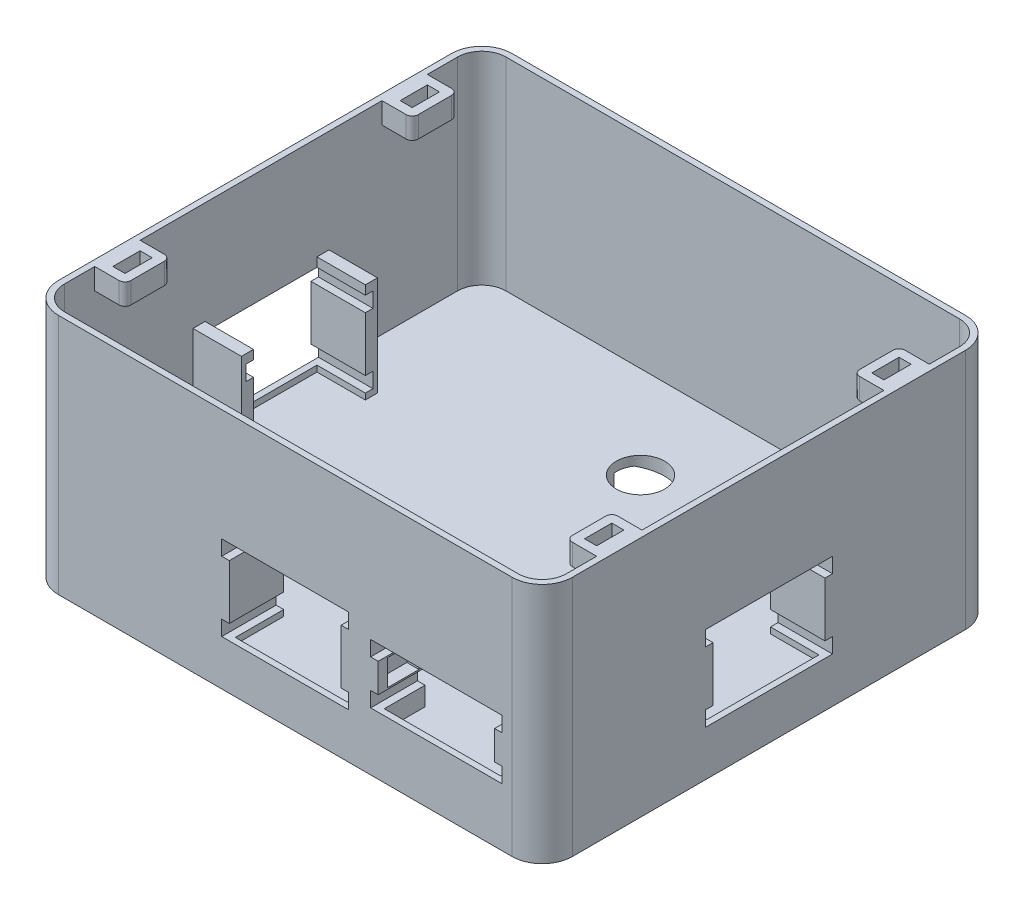
from build123d import *

# Parameters (mm, degrees)
SKETCH2_W                                  = 170
SKETCH2_H                                  = 150
BOSS_EXTRUDE1_DEPTH                        = 80
FILLET1_R                                  = 10
SHELL1_T                                   = -2
SHELL1_THICKNESS_2_DEPTH                   = 11
SKETCH5_W                                  = 2.5
SKETCH5_H                                  = 5
CUT_EXTRUDE1_DEPTH                         = 2
BOSS_EXTRUDE2_DEPTH                        = 16
SKETCH7_W                                  = 2.5
SKETCH7_H                                  = 5
CUT_EXTRUDE2_DEPTH                         = 2
BOSS_EXTRUDE3_DEPTH                        = 16
SKETCH10_W                                 = 2.5
SKETCH10_H                                 = 5
CUT_EXTRUDE4_DEPTH                         = 2
BOSS_EXTRUDE4_DEPTH                        = 16
SKETCH13_W                                 = 2.5
SKETCH13_H                                 = 5
CUT_EXTRUDE5_DEPTH                         = 2
BOSS_EXTRUDE5_DEPTH                        = 13.5
SKETCH15_W                                 = 10.5
SKETCH15_H                                 = 8.6
CUT_EXTRUDE6_DEPTH                         = 4
CUT_EXTRUDE8_REACH                         = 140.744
SKETCH20_R                                 = 8
SKETCH22_R                                 = 3
CUT_EXTRUDE9_DEPTH                         = 5
BOSS_EXTRUDE6_START                        = 60
SKETCH23_W                                 = 10
SKETCH23_H                                 = 15
BOSS_EXTRUDE6_DEPTH                        = 7
SKETCH24_W                                 = 4
SKETCH24_H                                 = 9
CUT_EXTRUDE10_DEPTH                        = 5
MIRROR1_START                              = 60
MIRROR1_AT_THE_SECOND_PLANE_COPY_1_SKETC_W = 10
MIRROR1_AT_THE_SECOND_PLANE_COPY_1_SKETC_H = 15
MIRROR1_AT_THE_SECOND_PLANE_COPY_1_DEPTH   = 7
MIRROR1_AT_THE_SECOND_PLANE_COPY_2_SKETC_W = 4
MIRROR1_AT_THE_SECOND_PLANE_COPY_2_SKETC_H = 9
MIRROR1_AT_THE_SECOND_PLANE_COPY_2_DEPTH   = 5
FILLET2_R                                  = 2
CUT_EXTRUDE14_DEPTH                        = 10
SKETCH30_R                                 = 6
CUT_EXTRUDE16_DEPTH                        = 10


with BuildPart() as part:
    # Sketch2 → Boss-Extrude1 (new body)
    with BuildSketch(Plane(origin=(0, 0, 0), x_dir=(1, 0, 0), z_dir=(0, 1, 0))):
        Rectangle(SKETCH2_W, SKETCH2_H)
    extrude(amount=BOSS_EXTRUDE1_DEPTH)

    # Fillet1
    fillet1_edges = [part.edges().sort_by_distance(p)[0] for p in [
        (85, 40, 75),
        (-85, 40, 75),
        (-85, 40, -75),
        (85, 40, -75),
    ]]
    fillet(fillet1_edges, radius=FILLET1_R)

    # Shell1
    shell1_openings = [part.faces().sort_by_distance(p)[0] for p in [
        (0, 80, 0),
    ]]
    offset(amount=SHELL1_T, openings=shell1_openings, kind=Kind.INTERSECTION)

    # Shell1 thickness 2 face (on inner face of the shell) → Shell1 thickness 2 (add)
    with BuildSketch(Plane(origin=(0, 2, 0), x_dir=(0, 0, -1), z_dir=(0, -1, 0))):
        with BuildLine():
            ThreePointArc((73, -75), (70.656854249, -80.656854249), (65, -83))
            Line((65, -83), (-65, -83))
            ThreePointArc((-65, -83), (-70.656854249, -80.656854249), (-73, -75))
            Line((-73, -75), (-73, 75))
            ThreePointArc((-73, 75), (-70.656854249, 80.656854249), (-65, 83))
            Line((-65, 83), (65, 83))
            ThreePointArc((65, 83), (70.656854249, 80.656854249), (73, 75))
            Line((73, 75), (73, -75))
        make_face()
    extrude(amount=-SHELL1_THICKNESS_2_DEPTH)

    # Sketch5 → Cut-Extrude1 (cut)
    with BuildSketch(Plane.XY.offset(75)):
        Polygon((18.5, 43), (-18.5, 43), (-18.5, 38), (-18.5, 20), (-18.5, 15), (18.5, 15), (18.5, 20), (18.5, 38), align=None)
        with Locations((-19.75, 40.5)):
            Rectangle(SKETCH5_W, SKETCH5_H)
        with Locations((19.75, 40.5)):
            Rectangle(SKETCH5_W, SKETCH5_H)
        with Locations((-19.75, 17.5)):
            Rectangle(SKETCH5_W, SKETCH5_H)
        with Locations((19.75, 17.5)):
            Rectangle(SKETCH5_W, SKETCH5_H)
    extrude(amount=-CUT_EXTRUDE1_DEPTH, mode=Mode.SUBTRACT)

    # Sketch6 → Boss-Extrude2 (add)
    with BuildSketch(Plane(origin=(0, 0, 73), x_dir=(-1, 0, 0), z_dir=(0, 0, -1))):
        Polygon((18.5, 13), (22.5, 13), (22.5, 46), (18.5, 46), (18.5, 43), (21, 43), (21, 38), (18.5, 38), (18.5, 20), (21, 20), (21, 15), (18.5, 15), align=None)
        Polygon((-22.5, 46), (-22.5, 13), (-18.5, 13), (-18.5, 15), (-21, 15), (-21, 20), (-18.5, 20), (-18.5, 38), (-21, 38), (-21, 43), (-18.5, 43), (-18.5, 46), align=None)
    extrude(amount=BOSS_EXTRUDE2_DEPTH)

    # Sketch7 → Cut-Extrude2 (cut)
    with BuildSketch(Plane(origin=(85, 0, 0), x_dir=(0, 0, -1), z_dir=(1, 0, 0))):
        Polygon((18.5, 43), (-18.5, 43), (-18.5, 38), (-18.5, 20), (-18.5, 15), (18.5, 15), (18.5, 20), (18.5, 38), align=None)
        with Locations((-19.75, 40.5)):
            Rectangle(SKETCH7_W, SKETCH7_H)
        with Locations((19.75, 40.5)):
            Rectangle(SKETCH7_W, SKETCH7_H)
        with Locations((-19.75, 17.5)):
            Rectangle(SKETCH7_W, SKETCH7_H)
        with Locations((19.75, 17.5)):
            Rectangle(SKETCH7_W, SKETCH7_H)
    extrude(amount=-CUT_EXTRUDE2_DEPTH, mode=Mode.SUBTRACT)

    # Sketch8 → Boss-Extrude3 (add)
    with BuildSketch(Plane.ZY.offset(-83)):
        Polygon((-22.5, 46), (-18.5, 46), (-18.5, 43), (-21, 43), (-21, 38), (-18.5, 38), (-18.5, 20), (-21, 20), (-21, 15), (-18.5, 15), (-18.5, 13), (-22.5, 13), align=None)
        Polygon((21, 43), (18.5, 43), (18.5, 46), (22.5, 46), (22.5, 13), (18.5, 13), (18.5, 15), (21, 15), (21, 20), (18.5, 20), (18.5, 38), (21, 38), align=None)
    extrude(amount=BOSS_EXTRUDE3_DEPTH)

    # Sketch10 → Cut-Extrude4 (cut)
    with BuildSketch(Plane.ZY.offset(85)):
        Polygon((18.5, 43), (-18.5, 43), (-18.5, 38), (-18.5, 20), (-18.5, 15), (18.5, 15), (18.5, 20), (18.5, 38), align=None)
        with Locations((-19.75, 40.5)):
            Rectangle(SKETCH10_W, SKETCH10_H)
        with Locations((19.75, 40.5)):
            Rectangle(SKETCH10_W, SKETCH10_H)
        with Locations((-19.75, 17.5)):
            Rectangle(SKETCH10_W, SKETCH10_H)
        with Locations((19.75, 17.5)):
            Rectangle(SKETCH10_W, SKETCH10_H)
    extrude(amount=-CUT_EXTRUDE4_DEPTH, mode=Mode.SUBTRACT)

    # Sketch11 → Boss-Extrude4 (add)
    with BuildSketch(Plane(origin=(-83, 0, 0), x_dir=(0, 0, -1), z_dir=(1, 0, 0))):
        Polygon((-18.5, 46), (-22.5, 46), (-22.5, 13), (-18.5, 13), (-18.5, 15), (-21, 15), (-21, 20), (-18.5, 20), (-18.5, 38), (-21, 38), (-21, 43), (-18.5, 43), align=None)
        Polygon((21, 43), (18.5, 43), (18.5, 46), (22.5, 46), (22.5, 13), (18.5, 13), (18.5, 15), (21, 15), (21, 20), (18.5, 20), (18.5, 38), (21, 38), align=None)
    extrude(amount=BOSS_EXTRUDE4_DEPTH)

    # Sketch13 → Cut-Extrude5 (cut)
    with BuildSketch(Plane.XY.offset(75)):
        with Locations((29.5, 36.3)):
            Rectangle(SKETCH13_W, SKETCH13_H)
        Polygon((69.25, 38.8), (30.75, 38.8), (30.75, 33.8), (30.75, 24.2), (30.75, 19.2), (69.25, 19.2), (69.25, 24.2), (69.25, 33.8), align=None)
        with Locations((70.5, 36.3)):
            Rectangle(SKETCH13_W, SKETCH13_H)
        with Locations((29.5, 21.7)):
            Rectangle(SKETCH13_W, SKETCH13_H)
        with Locations((70.5, 21.7)):
            Rectangle(SKETCH13_W, SKETCH13_H)
    extrude(amount=-CUT_EXTRUDE5_DEPTH, mode=Mode.SUBTRACT)

    # Sketch14 → Boss-Extrude5 (add)
    with BuildSketch(Plane(origin=(0, 0, 73), x_dir=(-1, 0, 0), z_dir=(0, 0, -1))):
        Polygon((-69.25, 41.8), (-73.25, 41.8), (-73.25, 13), (-69.25, 13), (-69.25, 19.2), (-71.75, 19.2), (-71.75, 24.2), (-69.25, 24.2), (-69.25, 33.8), (-71.75, 33.8), (-71.75, 38.8), (-69.25, 38.8), align=None)
        Polygon((-28.25, 38.8), (-30.75, 38.8), (-30.75, 41.8), (-26.75, 41.8), (-26.75, 13), (-30.75, 13), (-30.75, 19.2), (-28.25, 19.2), (-28.25, 24.2), (-30.75, 24.2), (-30.75, 33.8), (-28.25, 33.8), align=None)
    extrude(amount=BOSS_EXTRUDE5_DEPTH)

    # Sketch15 → Cut-Extrude6 (cut)
    with BuildSketch(Plane.ZY.offset(-26.75)):
        with Locations((66.75, 29)):
            Rectangle(SKETCH15_W, SKETCH15_H)
    extrude(amount=-CUT_EXTRUDE6_DEPTH, mode=Mode.SUBTRACT)

    # Sketch18 → Cut-Revolve1 (revolve, cut)
    with BuildSketch(Plane(origin=(0, 0, 0), x_dir=(0, 0, -1), z_dir=(1, 0, 0)), mode=Mode.PRIVATE) as cut_revolve1_sk:
        Polygon((-42.5, 0), (-70, 0), (-47.5, 10), (-42.5, 10), align=None)
    revolve(cut_revolve1_sk.sketch.rotate(Axis((0, 0, 0), (0, 1, 0)), 180), axis=Axis((0, 0, 0), (0, 1, 0)), mode=Mode.SUBTRACT)

    # Cut-Extrude8: up to this face of the body (flat: up to its plane)
    cut_extrude8_end = Plane(part.part.faces().sort_by_distance((-0.227953307, 13, -0.653255078))[0])
    # Sketch20 → Cut-Extrude8 (cut, up to the picked face)
    with BuildSketch(Plane.XZ, mode=Mode.PRIVATE) as cut_extrude8_sk1:
        with Locations(Location((0, -42.5, 0), (0, 0, 270))):
            Circle(SKETCH20_R)
    cut_extrude8_tool1 = split(extrude(cut_extrude8_sk1.sketch, amount=-CUT_EXTRUDE8_REACH, mode=Mode.PRIVATE), bisect_by=cut_extrude8_end, keep=Keep.BOTH, mode=Mode.PRIVATE)
    add(cut_extrude8_tool1.solids().sort_by(Axis((0, 0, -42.5), (0, 1, 0)))[0], mode=Mode.SUBTRACT)

    # Sketch22 → Cut-Extrude9 (cut)
    with BuildSketch(Plane.XZ):
        with Locations(Location((-67.928932188, 57.928932188, 0), (0, 0, 270))):
            Circle(SKETCH22_R)
        with Locations(Location((-67.928932188, -57.928932188, 0), (0, 0, 90))):
            Circle(SKETCH22_R)
        with Locations(Location((67.928932188, -57.928932188, 0), (0, 0, 270))):
            Circle(SKETCH22_R)
        with Locations(Location((67.928932188, 57.928932188, 0), (0, 0, 90))):
            Circle(SKETCH22_R)
    extrude(amount=-CUT_EXTRUDE9_DEPTH, mode=Mode.SUBTRACT)

    # Sketch23 → Boss-Extrude6 (add)
    with BuildSketch(Plane(origin=(0, 13, 0), x_dir=(1, 0, 0), z_dir=(0, 1, 0)).offset(BOSS_EXTRUDE6_START)):
        with Locations((-78, 47.5)):
            Rectangle(SKETCH23_W, SKETCH23_H)
    boss_extrude6 = extrude(amount=BOSS_EXTRUDE6_DEPTH)

    # Sketch24 → Cut-Extrude10 (cut)
    with BuildSketch(Plane(origin=(0, 80, 0), x_dir=(1, 0, 0), z_dir=(0, 1, 0))):
        with Locations((-78, 47.5)):
            Rectangle(SKETCH24_W, SKETCH24_H)
    cut_extrude10 = extrude(amount=-CUT_EXTRUDE10_DEPTH, mode=Mode.SUBTRACT)

    # Mirror1: Boss-Extrude6, Cut-Extrude10 across plane
    add(boss_extrude6.mirror(Plane(origin=(0, 0, 0), x_dir=(0, 0, 1), z_dir=(1, 0, 0))))
    add(cut_extrude10.mirror(Plane(origin=(0, 0, 0), x_dir=(0, 0, 1), z_dir=(1, 0, 0))), mode=Mode.SUBTRACT)

    # Mirror1 at the second plane: Boss-Extrude6, Cut-Extrude10 across plane
    add(boss_extrude6.mirror(Plane.XY))
    add(cut_extrude10.mirror(Plane.XY), mode=Mode.SUBTRACT)

    # Mirror1 at the second plane copy 1 sketc → Mirror1 at the second plane copy 1 (add)
    with BuildSketch(Plane(origin=(0, 13, 0), x_dir=(-1, 0, 0), z_dir=(0, 1, 0)).offset(MIRROR1_START)):
        with Locations((-78, 47.5)):
            Rectangle(MIRROR1_AT_THE_SECOND_PLANE_COPY_1_SKETC_W, MIRROR1_AT_THE_SECOND_PLANE_COPY_1_SKETC_H)
    extrude(amount=MIRROR1_AT_THE_SECOND_PLANE_COPY_1_DEPTH)

    # Mirror1 at the second plane copy 2 sketc → Mirror1 at the second plane copy 2 (cut)
    with BuildSketch(Plane(origin=(0, 80, 0), x_dir=(-1, 0, 0), z_dir=(0, 1, 0))):
        with Locations((-78, 47.5)):
            Rectangle(MIRROR1_AT_THE_SECOND_PLANE_COPY_2_SKETC_W, MIRROR1_AT_THE_SECOND_PLANE_COPY_2_SKETC_H)
    extrude(amount=-MIRROR1_AT_THE_SECOND_PLANE_COPY_2_DEPTH, mode=Mode.SUBTRACT)

    # Fillet2
    fillet2_edges = [part.edges().sort_by_distance(p)[0] for p in [
        (-73, 76.5, -40),
        (-73, 76.5, -55),
        (-73, 76.5, 40),
        (-73, 76.5, 55),
        (73, 76.5, -40),
        (73, 76.5, -55),
        (73, 76.5, 40),
        (73, 76.5, 55),
    ]]
    fillet(fillet2_edges, radius=FILLET2_R)

    # Sketch28 → Cut-Extrude14 (cut)
    with BuildSketch(Plane.XZ):
        with BuildLine():
            ThreePointArc((10.117209293, -38.182352941), (0, -31.5), (-10.117209293, -38.182352941))
            ThreePointArc((-10.117209293, -38.182352941), (0, 39.5), (10.117209293, -38.182352941))
        make_face()
    extrude(amount=-CUT_EXTRUDE14_DEPTH, mode=Mode.SUBTRACT)

    # Sketch30 → Cut-Extrude16 (cut)
    # profile 1 of 2: a face of its own
    with BuildSketch(Plane.XZ):
        with BuildLine():
            Line((12.041594579, -72), (75, -72))
            ThreePointArc((75, -72), (79.949747468, -69.949747468), (82, -65))
            Line((82, -65), (82, 65))
            ThreePointArc((82, 65), (79.949747468, 69.949747468), (75, 72))
            Line((75, 72), (12.041594579, 72))
            ThreePointArc((12.041594579, 72), (73, 0), (12.041594579, -72))
        make_face()
        with Locations(Location((67.928932188, 57.928932188, 0), (0, 0, 270))):
            Circle(SKETCH30_R, mode=Mode.SUBTRACT)
        with Locations(Location((67.928932188, -57.928932188, 0), (0, 0, 270))):
            Circle(SKETCH30_R, mode=Mode.SUBTRACT)
    # profile 2 of 2: a face of its own
    with BuildSketch(Plane.XZ):
        with BuildLine():
            Line((-12.041594579, 72), (-75, 72))
            ThreePointArc((-75, 72), (-79.949747468, 69.949747468), (-82, 65))
            Line((-82, 65), (-82, -65))
            ThreePointArc((-82, -65), (-79.949747468, -69.949747468), (-75, -72))
            Line((-75, -72), (-12.041594579, -72))
            ThreePointArc((-12.041594579, -72), (-73, 0), (-12.041594579, 72))
        make_face()
        with Locations(Location((-67.928932188, -57.928932188, 0), (0, 0, 270))):
            Circle(SKETCH30_R, mode=Mode.SUBTRACT)
        with Locations(Location((-67.928932188, 57.928932188, 0), (0, 0, 270))):
            Circle(SKETCH30_R, mode=Mode.SUBTRACT)
    extrude(amount=-CUT_EXTRUDE16_DEPTH, mode=Mode.SUBTRACT)


solid = part.part
